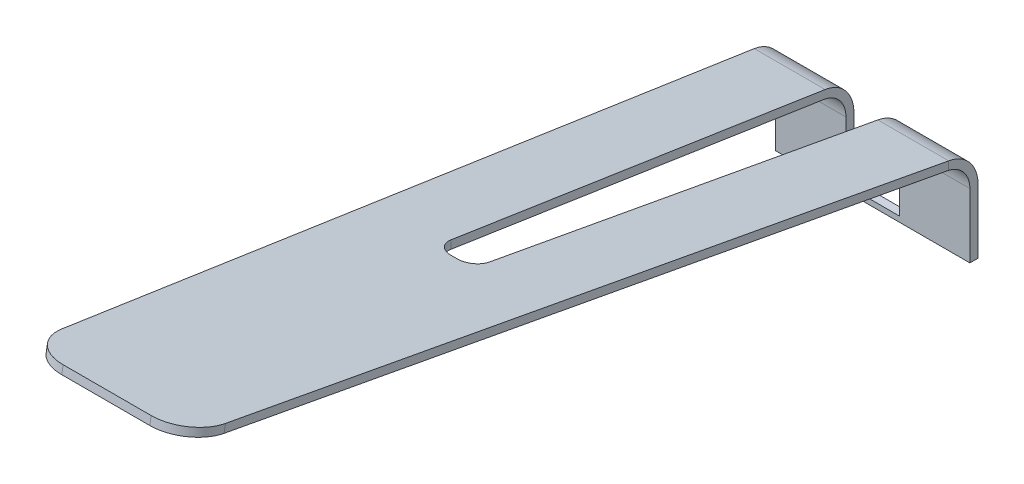
from build123d import *

# Parameters (mm, degrees)
SHORT_LEVER_DEPTH      = 1.8
SHORT_LEVER_DEPTH_BACK = 1.8
LEVER_CUT_DEPTH        = 4.04793
FILLET_1_R             = 0.7


with BuildPart() as part:
    # Short → Short_Lever (new, two sides: drawn at the far end of the back side and taken through both)
    with BuildSketch(Plane(origin=(2.85, 0, 0), x_dir=(0, 0, -1), z_dir=(1, 0, 0)).offset(-SHORT_LEVER_DEPTH_BACK)):
        with BuildLine():
            Line((5.55, 4.85), (5.55, 6.042820323))
            ThreePointArc((5.55, 6.042820323), (5.431703238, 6.365779512), (5.132789449, 6.535918596))
            Line((5.132789449, 6.535918596), (-8.65, 8.85))
            Line((-8.65, 8.85), (-8.625163165, 8.997929482))
            Line((-8.625163165, 8.997929482), (5.157626284, 6.683848078))
            ThreePointArc((5.157626284, 6.683848078), (5.54621421, 6.462667269), (5.7, 6.042820323))
            Line((5.7, 6.042820323), (5.7, 4.85))
            Line((5.7, 4.85), (5.55, 4.85))
        make_face()
    extrude(amount=SHORT_LEVER_DEPTH + SHORT_LEVER_DEPTH_BACK)

    # Эскиз2 → Lever_Cut (cut)
    with BuildSketch(Plane(origin=(0, 4.95, 0), x_dir=(1, 0, 0), z_dir=(0, 1, 0))):
        Polygon((1.05, 5.157626284), (1.35, -8.65), (1.05, -8.65), align=None)
        Polygon((4.65, 5.157626284), (4.65, -8.65), (4.35, -8.65), align=None)
        with BuildLine():
            Line((2.35, 5.8), (3.35, 5.8))
            Line((3.35, 5.8), (3.20551955, -1.905624011))
            ThreePointArc((3.20551955, -1.905624011), (3.115706509, -2.11411119), (2.90557227, -2.2))
            Line((2.90557227, -2.2), (2.79442773, -2.2))
            ThreePointArc((2.79442773, -2.2), (2.584293491, -2.11411119), (2.49448045, -1.905624011))
            Line((2.49448045, -1.905624011), (2.35, 5.8))
        make_face()
    extrude(amount=LEVER_CUT_DEPTH, mode=Mode.SUBTRACT)

    # Скругление1
    fillet_1_edges = [part.edges().sort_by_distance(p)[0] for p in [
        (1.349730184, 8.923964741, 8.637581583),
        (4.350269816, 8.923964741, 8.637581583),
    ]]
    fillet(fillet_1_edges, radius=FILLET_1_R)


solid = part.part
